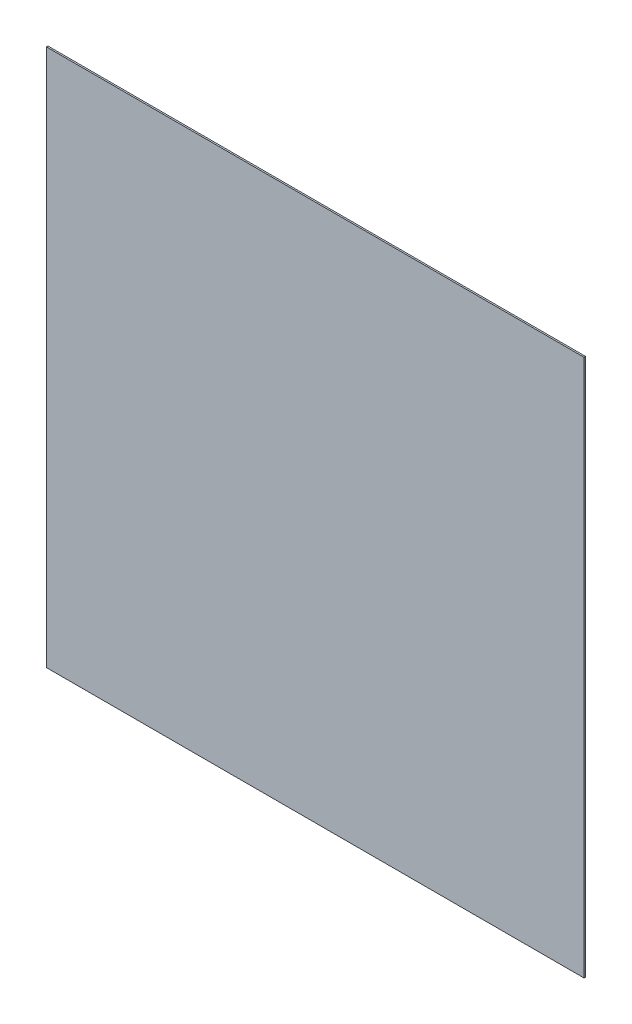
from build123d import *

# Parameters (mm, degrees)
ESQUISSE1_W        = 700
ESQUISSE1_H        = 700
BOSS_EXTRU_1_DEPTH = 2


with BuildPart() as part:
    # Esquisse1 → Boss.-Extru.1 (new body)
    with BuildSketch(Plane.XY):
        Rectangle(ESQUISSE1_W, ESQUISSE1_H)
    extrude(amount=BOSS_EXTRU_1_DEPTH)


solid = part.part
